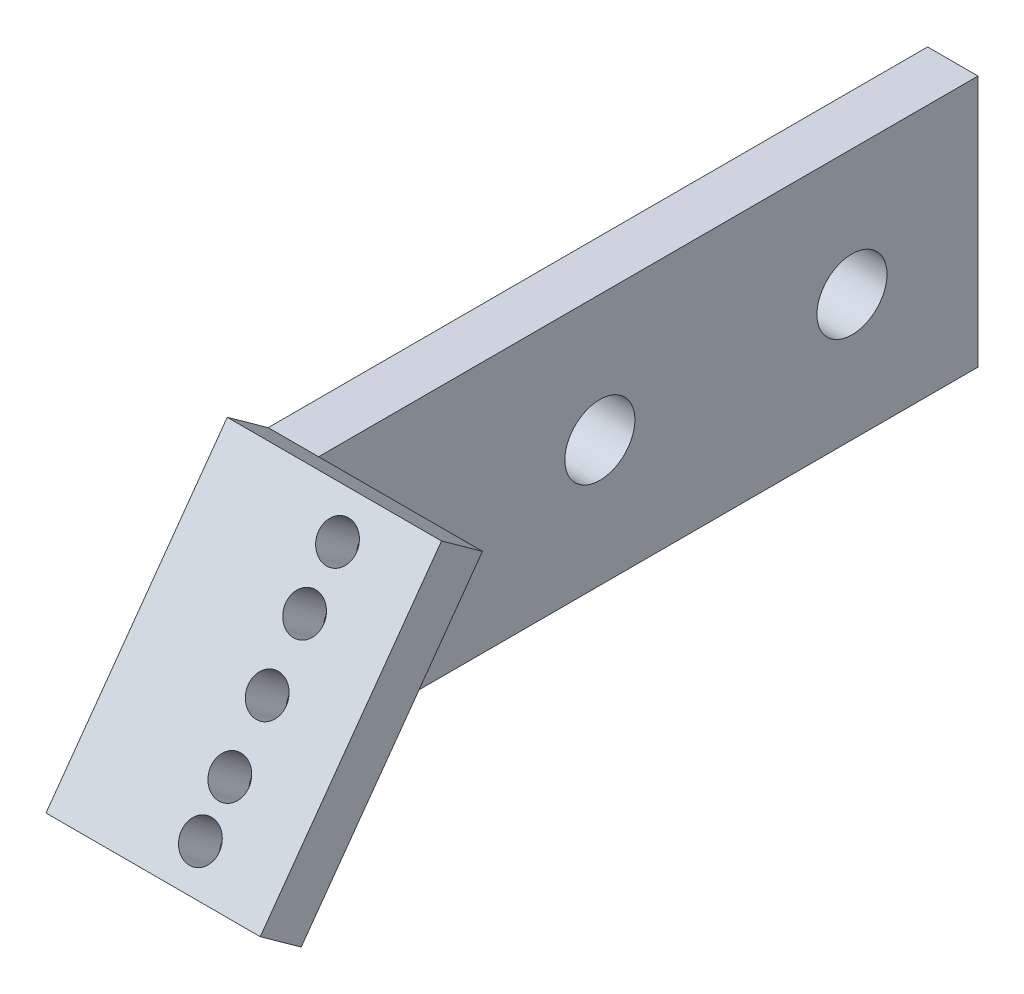
from build123d import *

# Parameters (mm, degrees)
SKETCH1_W           = 40
SKETCH1_H           = 20
SKETCH1_R           = 2.78
BOSS_EXTRUDE1_DEPTH = 4
SKETCH6_W           = 17
SKETCH6_H           = 24.632994134
SKETCH6_R           = 1.5
BOSS_EXTRUDE2_DEPTH = 4


with BuildPart() as part:
    # Sketch1 → Boss-Extrude1 (new body)
    with BuildSketch(Plane(origin=(0, 0, 0), x_dir=(0, 0, -1), z_dir=(1, 0, 0))):
        with Locations((10, -10)):
            Rectangle(SKETCH1_W, SKETCH1_H)
        with Locations((0, -10)):
            Circle(SKETCH1_R, mode=Mode.SUBTRACT)
        with Locations((20, -10)):
            Circle(SKETCH1_R, mode=Mode.SUBTRACT)
    extrude(amount=BOSS_EXTRUDE1_DEPTH)

    # Sketch5 → section 0 of loft1
    with BuildSketch(Plane(origin=(0, 10.577438307, 14.711318924), x_dir=(1, 0, 0), z_dir=(0, 0.5837698787992286, 0.8119191638375918)), mode=Mode.PRIVATE) as loft1_s0:
        with BuildLine():
            Line((0, -13.027698788), (4, -13.027698788))
            Line((4, -13.027698788), (4, -37.660692922))
            Line((4, -37.660692922), (0, -37.660692922))
            Line((0, -37.660692922), (0, -13.027698788))
        make_face()
    # loft up to a face of the part (loft1)
    loft([loft1_s0.sketch, part.faces().sort_by_distance((2, -10, 10))[0]])

    # Sketch6 → Boss-Extrude2 (add)
    with BuildSketch(Plane(origin=(0, 10.577438307, 14.711318924), x_dir=(1, 0, 0), z_dir=(0, 0.5837698787992287, 0.8119191638375917))):
        with Locations((8.5, -25.344195855)):
            Rectangle(SKETCH6_W, SKETCH6_H)
        with Locations(Location((10.5, -20.500692922, 0), (0, 0, 270))):
            Circle(SKETCH6_R, mode=Mode.SUBTRACT)
        with Locations(Location((10.5, -25.580692922, 0), (0, 0, 270))):
            Circle(SKETCH6_R, mode=Mode.SUBTRACT)
        with Locations(Location((10.5, -30.660692922, 0), (0, 0, 270))):
            Circle(SKETCH6_R, mode=Mode.SUBTRACT)
        with Locations(Location((10.5, -34.660692922, 0), (0, 0, 270))):
            Circle(SKETCH6_R, mode=Mode.SUBTRACT)
        with Locations(Location((10.5, -16.027698788, 0), (0, 0, 270))):
            Circle(SKETCH6_R, mode=Mode.SUBTRACT)
    extrude(amount=BOSS_EXTRUDE2_DEPTH)


solid = part.part
